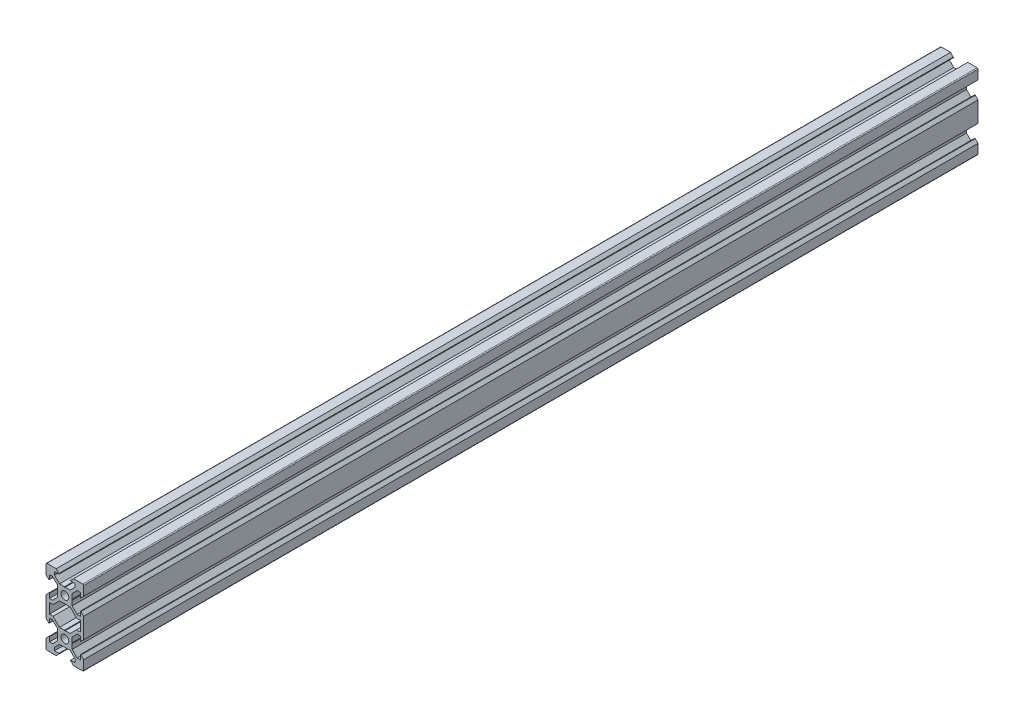
from build123d import *
from build123d.topology import SkipClean

# Parameters (mm, degrees)
BOSS_EXTRU_1_DEPTH     = 475
SYM_TRIE6_COPY_1_DEPTH = 475


with BuildPart() as part:
    # Esquisse1 → Boss.-Extru.1 (new body)
    with BuildSketch(Plane.XY):
        with BuildLine():
            Line((-9.5, 10), (-4.58, 10))
            Line((-4.58, 10), (-3.125, 8.545))
            Line((-3.125, 8.545), (-3.125, 8.2))
            Line((-3.125, 8.2), (-5.5, 8.2))
            Line((-5.5, 8.2), (-5.5, 6.560660172))
            Line((-5.5, 6.560660172), (-2.839339828, 3.9))
            Line((-2.839339828, 3.9), (-0.21, 3.9))
            Line((-0.21, 3.9), (0, 3.69))
            Line((0, 3.69), (0, 2.1))
            ThreePointArc((0, 2.1), (-2.1, 0), (0, -2.1))
            Line((0, -2.1), (0, -3.69))
            Line((0, -3.69), (-0.21, -3.9))
            Line((-0.21, -3.9), (-2.839339828, -3.9))
            Line((-2.839339828, -3.9), (-6.239339828, -7.3))
            Line((-6.239339828, -7.3), (-8.2, -7.3))
            Line((-8.2, -7.3), (-8.2, -10))
            Line((-8.2, -10), (-10, -10))
            Line((-10, -10), (-10, -4.58))
            Line((-10, -4.58), (-8.545, -3.125))
            Line((-8.545, -3.125), (-8.2, -3.125))
            Line((-8.2, -3.125), (-8.2, -5.5))
            Line((-8.2, -5.5), (-6.560660172, -5.5))
            Line((-6.560660172, -5.5), (-3.9, -2.839339828))
            Line((-3.9, -2.839339828), (-3.9, -0.21))
            Line((-3.9, -0.21), (-3.69, 0))
            Line((-3.69, 0), (-3.9, 0.21))
            Line((-3.9, 0.21), (-3.9, 2.839339828))
            Line((-3.9, 2.839339828), (-6.560660172, 5.5))
            Line((-6.560660172, 5.5), (-8.2, 5.5))
            Line((-8.2, 5.5), (-8.2, 3.125))
            Line((-8.2, 3.125), (-8.545, 3.125))
            Line((-8.545, 3.125), (-10, 4.58))
            Line((-10, 4.58), (-10, 9.5))
            ThreePointArc((-10, 9.5), (-9.853553391, 9.853553391), (-9.5, 10))
        make_face()
    boss_extru_1 = extrude(amount=BOSS_EXTRU_1_DEPTH)

    # Symétrie1: Boss.-Extru.1 across plane
    add(boss_extru_1.mirror(Plane(origin=(0, 3.69, 475), x_dir=(0, 0, 1), z_dir=(-1, 0, 0))))

    # Symétrie6: Boss.-Extru.1 across plane
    add(boss_extru_1.mirror(Plane(origin=(-8.2, -10, 475), x_dir=(0, 0, 1), z_dir=(0, 1, 0))))

    # Symétrie6 copy 1 sketch → Symétrie6 copy 1 (add)
    with SkipClean():  # the faces are left unmerged after this step: merging them gives an invalid solid
        with BuildSketch(Plane(origin=(0, -20, 0), x_dir=(-1, 0, 0), z_dir=(0, 0, 1))):
            with BuildLine():
                Line((-9.5, 10), (-4.58, 10))
                Line((-4.58, 10), (-3.125, 8.545))
                Line((-3.125, 8.545), (-3.125, 8.2))
                Line((-3.125, 8.2), (-5.5, 8.2))
                Line((-5.5, 8.2), (-5.5, 6.560660172))
                Line((-5.5, 6.560660172), (-2.839339828, 3.9))
                Line((-2.839339828, 3.9), (-0.21, 3.9))
                Line((-0.21, 3.9), (0, 3.69))
                Line((0, 3.69), (0, 2.1))
                ThreePointArc((0, 2.1), (-2.1, 0), (0, -2.1))
                Line((0, -2.1), (0, -3.69))
                Line((0, -3.69), (-0.21, -3.9))
                Line((-0.21, -3.9), (-2.839339828, -3.9))
                Line((-2.839339828, -3.9), (-6.239339828, -7.3))
                Line((-6.239339828, -7.3), (-8.2, -7.3))
                Line((-8.2, -7.3), (-8.2, -10))
                Line((-8.2, -10), (-10, -10))
                Line((-10, -10), (-10, -4.58))
                Line((-10, -4.58), (-8.545, -3.125))
                Line((-8.545, -3.125), (-8.2, -3.125))
                Line((-8.2, -3.125), (-8.2, -5.5))
                Line((-8.2, -5.5), (-6.560660172, -5.5))
                Line((-6.560660172, -5.5), (-3.9, -2.839339828))
                Line((-3.9, -2.839339828), (-3.9, -0.21))
                Line((-3.9, -0.21), (-3.69, 0))
                Line((-3.69, 0), (-3.9, 0.21))
                Line((-3.9, 0.21), (-3.9, 2.839339828))
                Line((-3.9, 2.839339828), (-6.560660172, 5.5))
                Line((-6.560660172, 5.5), (-8.2, 5.5))
                Line((-8.2, 5.5), (-8.2, 3.125))
                Line((-8.2, 3.125), (-8.545, 3.125))
                Line((-8.545, 3.125), (-10, 4.58))
                Line((-10, 4.58), (-10, 9.5))
                ThreePointArc((-10, 9.5), (-9.853553391, 9.853553391), (-9.5, 10))
            make_face()
        extrude(amount=SYM_TRIE6_COPY_1_DEPTH)


solid = part.part
